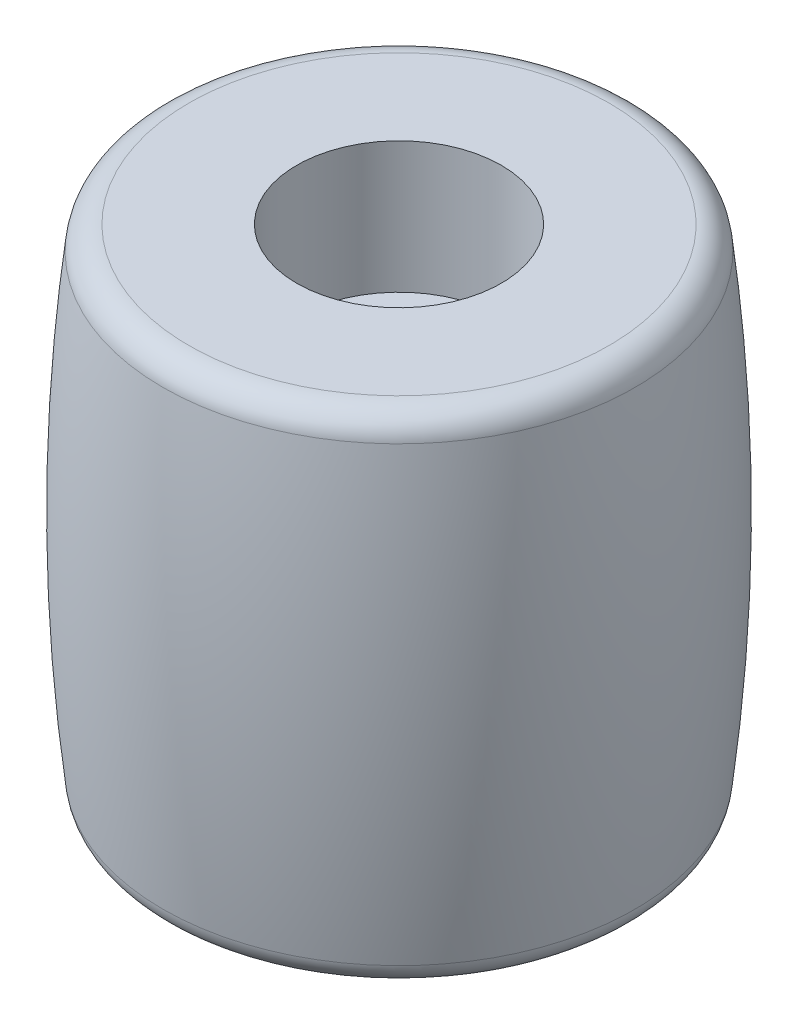
from build123d import *

# Parameters (mm, degrees)
FILLET_1_R = 1


with BuildPart() as part:
    # 草图1 → 旋转1 (revolve)
    with BuildSketch(Plane.XY, mode=Mode.PRIVATE) as revolve_1_sk:
        with BuildLine():
            Line((-2.5, -4.5), (-2.5, 4.5))
            Line((-2.5, 4.5), (-3.9, 4.5))
            Line((-3.9, 4.5), (-3.9, 9.5))
            Line((-3.9, 9.5), (-8.895900425, 9.5))
            ThreePointArc((-8.895900425, 9.5), (-9.5, 0), (-8.895900425, -9.5))
            Line((-8.895900425, -9.5), (-3.9, -9.5))
            Line((-3.9, -9.5), (-3.9, -4.5))
            Line((-3.9, -4.5), (-2.5, -4.5))
        make_face()
    revolve(revolve_1_sk.sketch.rotate(Axis((0, 0, 0), (0, 1, 0)), 270), axis=Axis((0, 0, 0), (0, 1, 0)))

    # 圆角1
    fillet_1_edges = [part.edges().sort_by_distance(p)[0] for p in [
        (0, -9.5, 8.895900425),
        (0, 9.5, 8.895900425),
    ]]
    fillet(fillet_1_edges, radius=FILLET_1_R)


solid = part.part
